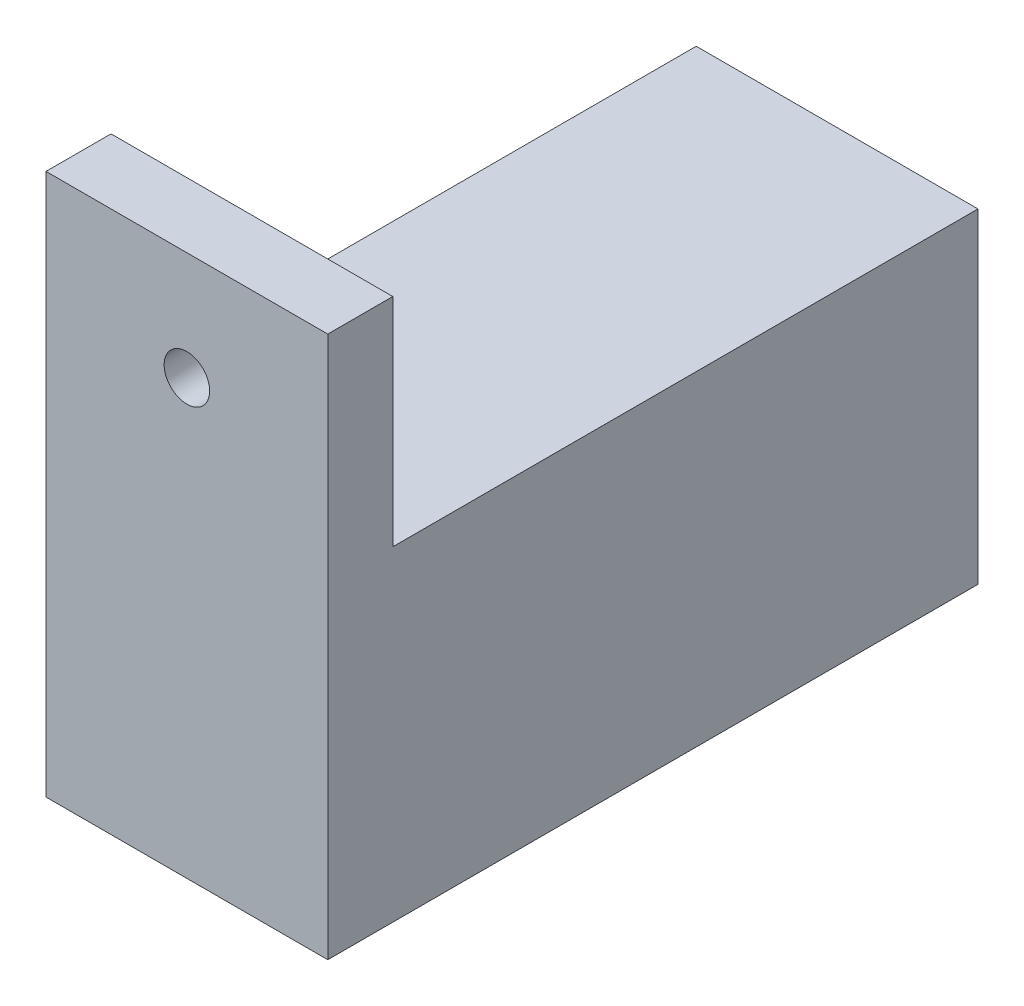
from build123d import *

# Parameters (mm, degrees)
SKETCH1_W           = 13
SKETCH1_H           = 30
BOSS_EXTRUDE1_DEPTH = 15
SKETCH2_W           = 13
SKETCH2_H           = 3
BOSS_EXTRUDE2_DEPTH = 10
SKETCH3_R           = 1.05
CUT_EXTRUDE1_DEPTH  = 52.833163371


with BuildPart() as part:
    # Sketch1 → Boss-Extrude1 (new body)
    with BuildSketch(Plane(origin=(0, 0, 0), x_dir=(1, 0, 0), z_dir=(0, 1, 0))):
        with Locations((-30.005846449, -1.517902626)):
            Rectangle(SKETCH1_W, SKETCH1_H)
    extrude(amount=BOSS_EXTRUDE1_DEPTH)

    # Sketch2 → Boss-Extrude2 (add)
    with BuildSketch(Plane(origin=(0, 15, 0), x_dir=(1, 0, 0), z_dir=(0, 1, 0))):
        with Locations((-30.005846449, -15.017902626)):
            Rectangle(SKETCH2_W, SKETCH2_H)
    extrude(amount=BOSS_EXTRUDE2_DEPTH)

    # Sketch3 → Cut-Extrude1 (cut, through all)
    with BuildSketch(Plane(origin=(0, 0, 13.517902626), x_dir=(-1, 0, 0), z_dir=(0, 0, -1))):
        with Locations((30.005846449, 20)):
            Circle(SKETCH3_R)
    extrude(amount=-CUT_EXTRUDE1_DEPTH, mode=Mode.SUBTRACT)


solid = part.part
